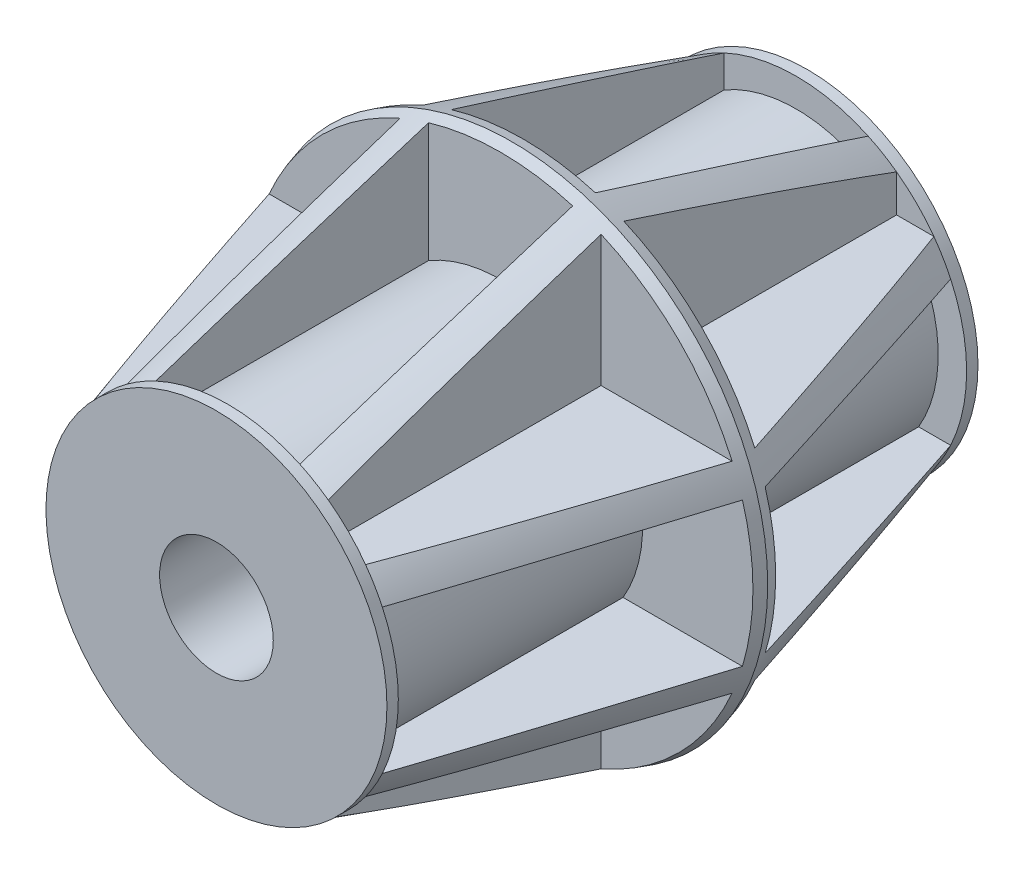
from build123d import *

# Parameters (mm, degrees)
FRONT_CONNECTOR_SKETCH_R      = 30
FRONT_CONNECTOR_EXTRUDE_DEPTH = 2
BACK_CONNECTOR_SKETCH_R       = 30
BACK_CONNECTOR_EXTRUDE_DEPTH  = 2
MID_RING_SKETCH_R             = 45
BACK_START                    = 2
BACK_CROSS_CUT_DEPTH          = 48.000004
FRONT_START                   = -50.000001
FRONT_CROSS_CUT_DEPTH         = 48.000002
PIN_HOLE_CUT_DEPTH            = 2
PIN_HOLE_CUT_DEPTH_BACK       = 40
PIN_HOLE_SKETCH_R             = 10


with BuildPart() as part:
    # Front Connector Sketch → Front Connector Extrude (new body)
    with BuildSketch(Plane.XY):
        Circle(FRONT_CONNECTOR_SKETCH_R)
    extrude(amount=-FRONT_CONNECTOR_EXTRUDE_DEPTH)

    # Mid Ring Sketch → section 1 of front_loft
    with BuildSketch(Plane.XY.offset(50), mode=Mode.PRIVATE) as front_loft_s1:
        Circle(MID_RING_SKETCH_R)
    # loft from a face of the part (front_loft)
    loft([part.faces().sort_by_distance((0, 0, 0))[0], front_loft_s1.sketch])



with BuildPart() as body_2:
    # Back Connector Sketch → Back Connector Extrude (new body)
    with BuildSketch(Plane.XY.offset(100)):
        Circle(BACK_CONNECTOR_SKETCH_R)
    extrude(amount=BACK_CONNECTOR_EXTRUDE_DEPTH)


with BuildPart() as part_1:
    add(part.part)

    add(body_2.part)  # back_loft joins it to this body
    # loft up to a face of the part (back_loft)
    loft([Face(Wire([part_1.edges().sort_by_distance((-30.804619767, 32.803588234, 50))[0]])), part_1.faces().sort_by_distance((0, 0, 100))[0]])

    # Cross Cut Sketch → Back Cross Cut (cut)
    with BuildSketch(Plane.XY.offset(50).offset(BACK_START)):
        with BuildLine():
            Line((-12.67766953, 43.177270586), (-12.67766953, 21.5470809))
            ThreePointArc((-12.67766953, 21.5470809), (0, 25), (12.67766953, 21.5470809))
            Line((12.67766953, 21.5470809), (12.67766953, 43.177270586))
            ThreePointArc((12.67766953, 43.177270586), (0, 45), (-12.67766953, 43.177270586))
        make_face()
        with BuildLine():
            Line((-12.67766953, -21.5470809), (-12.67766953, -43.177270586))
            ThreePointArc((-12.67766953, -43.177270586), (0, -45), (12.67766953, -43.177270586))
            Line((12.67766953, -43.177270586), (12.67766953, -21.5470809))
            ThreePointArc((12.67766953, -21.5470809), (0, -25), (-12.67766953, -21.5470809))
        make_face()
        with BuildLine():
            Line((17.67766953, 41.382363393), (17.67766953, 17.67766953))
            Line((17.67766953, 17.67766953), (41.382363393, 17.67766953))
            ThreePointArc((41.382363393, 17.67766953), (31.819805153, 31.819805153), (17.67766953, 41.382363393))
        make_face()
        with BuildLine():
            Line((17.67766953, -17.67766953), (17.67766953, -41.382363393))
            ThreePointArc((17.67766953, -41.382363393), (31.819805153, -31.819805153), (41.382363393, -17.67766953))
            Line((41.382363393, -17.67766953), (17.67766953, -17.67766953))
        make_face()
        with BuildLine():
            Line((-17.67766953, 41.382363393), (-17.67766953, 17.67766953))
            Line((-17.67766953, 17.67766953), (-41.382363393, 17.67766953))
            ThreePointArc((-41.382363393, 17.67766953), (-31.819805153, 31.819805153), (-17.67766953, 41.382363393))
        make_face()
        with BuildLine():
            Line((-17.67766953, -17.67766953), (-17.67766953, -41.382363393))
            ThreePointArc((-17.67766953, -41.382363393), (-31.819805153, -31.819805153), (-41.382363393, -17.67766953))
            Line((-41.382363393, -17.67766953), (-17.67766953, -17.67766953))
        make_face()
        with BuildLine():
            Line((43.177270586, 12.67766953), (21.5470809, 12.67766953))
            ThreePointArc((21.5470809, 12.67766953), (25, 0), (21.5470809, -12.67766953))
            Line((21.5470809, -12.67766953), (43.177270586, -12.67766953))
            ThreePointArc((43.177270586, -12.67766953), (45, 0), (43.177270586, 12.67766953))
        make_face()
        with BuildLine():
            Line((-21.5470809, 12.67766953), (-43.177270586, 12.67766953))
            ThreePointArc((-43.177270586, 12.67766953), (-45, 0), (-43.177270586, -12.67766953))
            Line((-43.177270586, -12.67766953), (-21.5470809, -12.67766953))
            ThreePointArc((-21.5470809, -12.67766953), (-25, 0), (-21.5470809, 12.67766953))
        make_face()
    extrude(amount=BACK_CROSS_CUT_DEPTH, mode=Mode.SUBTRACT)

    # Cross Cut Sketch<2> → Front Cross Cut (cut)
    with BuildSketch(Plane.XY.offset(50).offset(FRONT_START)):
        with BuildLine():
            Line((-12.67766953, 43.177270586), (-12.67766953, 21.5470809))
            ThreePointArc((-12.67766953, 21.5470809), (0, 25), (12.67766953, 21.5470809))
            Line((12.67766953, 21.5470809), (12.67766953, 43.177270586))
            ThreePointArc((12.67766953, 43.177270586), (0, 45), (-12.67766953, 43.177270586))
        make_face()
        with BuildLine():
            Line((-12.67766953, -21.5470809), (-12.67766953, -43.177270586))
            ThreePointArc((-12.67766953, -43.177270586), (0, -45), (12.67766953, -43.177270586))
            Line((12.67766953, -43.177270586), (12.67766953, -21.5470809))
            ThreePointArc((12.67766953, -21.5470809), (0, -25), (-12.67766953, -21.5470809))
        make_face()
        with BuildLine():
            Line((17.67766953, 41.382363393), (17.67766953, 17.67766953))
            Line((17.67766953, 17.67766953), (41.382363393, 17.67766953))
            ThreePointArc((41.382363393, 17.67766953), (31.819805153, 31.819805153), (17.67766953, 41.382363393))
        make_face()
        with BuildLine():
            Line((17.67766953, -17.67766953), (17.67766953, -41.382363393))
            ThreePointArc((17.67766953, -41.382363393), (31.819805153, -31.819805153), (41.382363393, -17.67766953))
            Line((41.382363393, -17.67766953), (17.67766953, -17.67766953))
        make_face()
        with BuildLine():
            Line((-17.67766953, 41.382363393), (-17.67766953, 17.67766953))
            Line((-17.67766953, 17.67766953), (-41.382363393, 17.67766953))
            ThreePointArc((-41.382363393, 17.67766953), (-31.819805153, 31.819805153), (-17.67766953, 41.382363393))
        make_face()
        with BuildLine():
            Line((-17.67766953, -17.67766953), (-17.67766953, -41.382363393))
            ThreePointArc((-17.67766953, -41.382363393), (-31.819805153, -31.819805153), (-41.382363393, -17.67766953))
            Line((-41.382363393, -17.67766953), (-17.67766953, -17.67766953))
        make_face()
        with BuildLine():
            Line((43.177270586, 12.67766953), (21.5470809, 12.67766953))
            ThreePointArc((21.5470809, 12.67766953), (25, 0), (21.5470809, -12.67766953))
            Line((21.5470809, -12.67766953), (43.177270586, -12.67766953))
            ThreePointArc((43.177270586, -12.67766953), (45, 0), (43.177270586, 12.67766953))
        make_face()
        with BuildLine():
            Line((-21.5470809, 12.67766953), (-43.177270586, 12.67766953))
            ThreePointArc((-43.177270586, 12.67766953), (-45, 0), (-43.177270586, -12.67766953))
            Line((-43.177270586, -12.67766953), (-21.5470809, -12.67766953))
            ThreePointArc((-21.5470809, -12.67766953), (-25, 0), (-21.5470809, 12.67766953))
        make_face()
    extrude(amount=FRONT_CROSS_CUT_DEPTH, mode=Mode.SUBTRACT)

    # Pin Hole Sketch → Pin Hole Cut (cut, two sides: drawn at the far end of the back side and taken through both)
    with BuildSketch(Plane.XY.offset(100).offset(-PIN_HOLE_CUT_DEPTH_BACK)):
        Circle(PIN_HOLE_SKETCH_R)
    extrude(amount=PIN_HOLE_CUT_DEPTH + PIN_HOLE_CUT_DEPTH_BACK, mode=Mode.SUBTRACT)


solid = part_1.part
